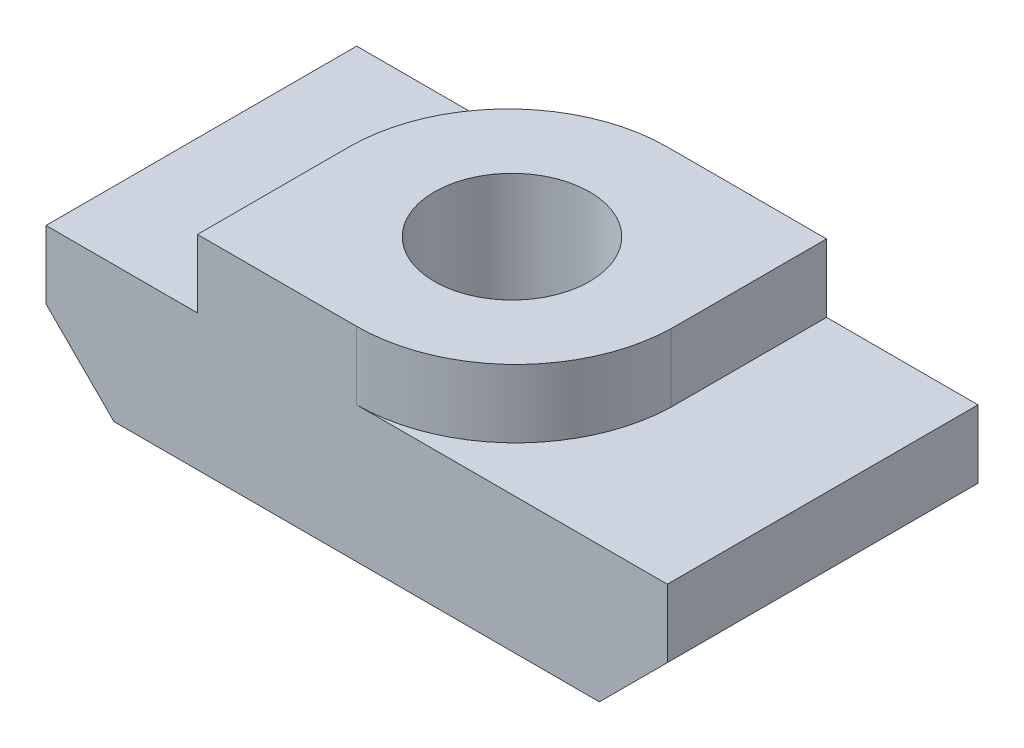
from build123d import *

# Parameters (mm, degrees)
BOSS_EXTRUDE1_DEPTH = 8
SKETCH2_R           = 2
CUT_EXTRUDE1_DEPTH  = 8
CUT_EXTRUDE2_DEPTH  = 1.75


with BuildPart() as part:
    # Sketch1 → Boss-Extrude1 (new body)
    with BuildSketch(Plane.XY):
        Polygon((0, 5.25), (0, 0), (6.25, 0), (8, 1.75), (8, 3.5), (4.1, 3.5), (4.1, 5.25), align=None)
    extrude(amount=BOSS_EXTRUDE1_DEPTH)

    # Mirror1: part across plane


with BuildPart() as part_1:
    add(part.part)
    add(part.part.mirror(Plane(origin=(0, 0, 0), x_dir=(0, 0, 1), z_dir=(1, 0, 0))))

    # Sketch2 → Cut-Extrude1 (cut)
    with BuildSketch(Plane(origin=(0, 5.25, 0), x_dir=(1, 0, 0), z_dir=(0, 1, 0))):
        with Locations(Location((0, -4, 0), (0, 0, 270))):
            Circle(SKETCH2_R)
    extrude(amount=-CUT_EXTRUDE1_DEPTH, mode=Mode.SUBTRACT)

    # Sketch3 → Cut-Extrude2 (cut)
    with BuildSketch(Plane(origin=(0, 5.25, 0), x_dir=(1, 0, 0), z_dir=(0, 1, 0))):
        with BuildLine():
            ThreePointArc((4.1, -4), (2.864000698, -6.834350716), (0, -8))
            Line((0, -8), (4.1, -8))
            Line((4.1, -8), (4.1, -4))
        make_face()
        with BuildLine():
            Line((-4.1, 0), (-4.1, -4.1))
            ThreePointArc((-4.1, -4.1), (-2.899137803, -1.200862197), (0, 0))
            Line((0, 0), (-4.1, 0))
        make_face()
    extrude(amount=-CUT_EXTRUDE2_DEPTH, mode=Mode.SUBTRACT)


solid = part_1.part
